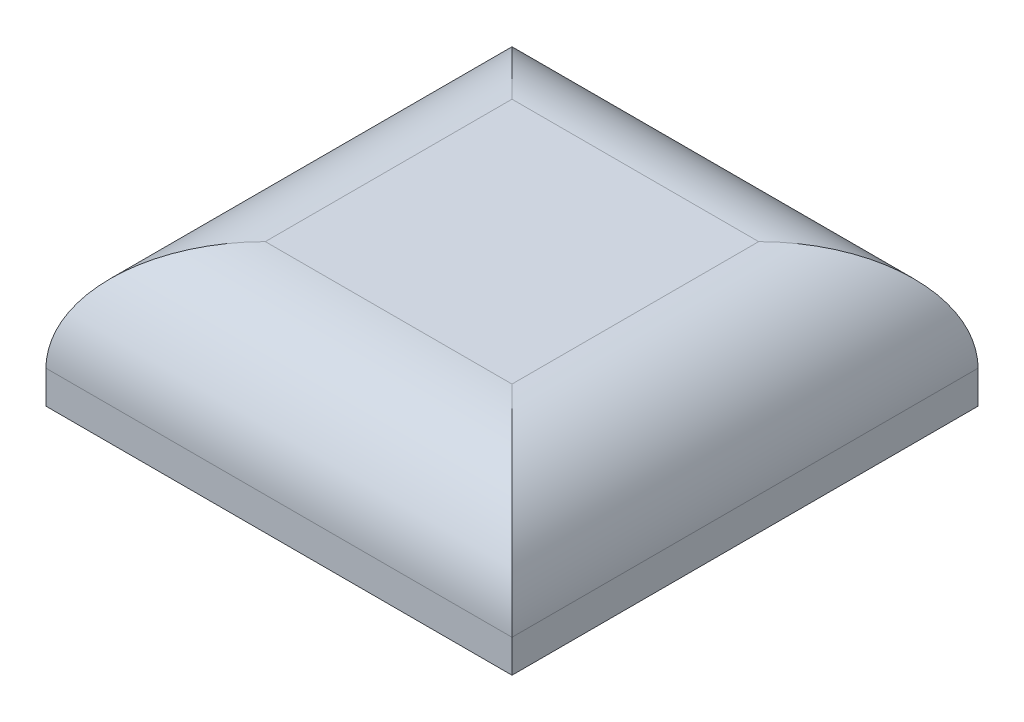
from build123d import *

# Parameters (mm, degrees)
SKETCH1_W           = 42.5
SKETCH1_H           = 42.5
BOSS_EXTRUDE1_DEPTH = 13
FILLET1_R           = 10


with BuildPart() as part:
    # Sketch1 → Boss-Extrude1 (new body)
    with BuildSketch(Plane(origin=(0, 0, 0), x_dir=(1, 0, 0), z_dir=(0, 1, 0))):
        Rectangle(SKETCH1_W, SKETCH1_H)
    extrude(amount=BOSS_EXTRUDE1_DEPTH)

    # Fillet1
    fillet1_edges = [part.edges().sort_by_distance(p)[0] for p in [
        (-21.25, 13, 0),
        (0, 13, 21.25),
        (21.25, 13, 0),
        (0, 13, -21.25),
    ]]
    fillet(fillet1_edges, radius=FILLET1_R)


solid = part.part
